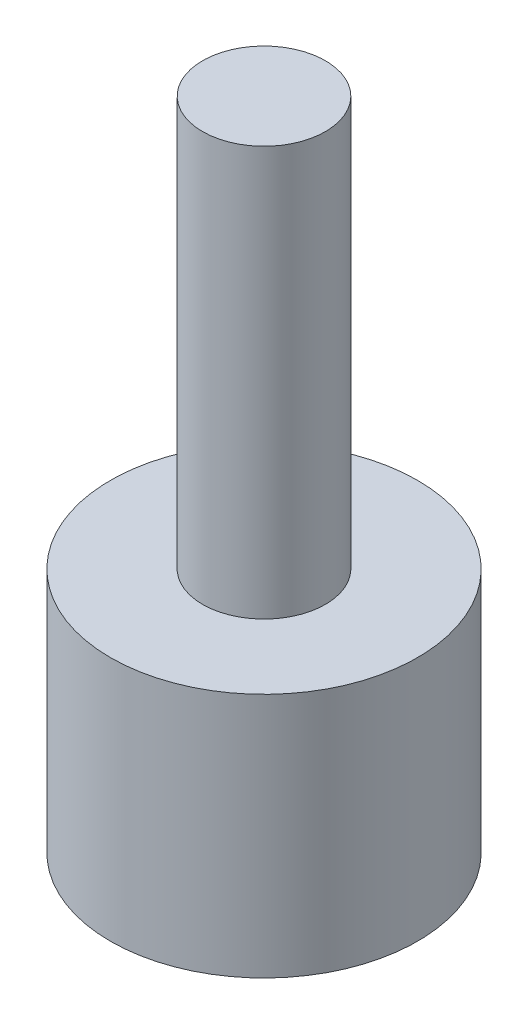
from build123d import *

# Parameters (mm, degrees)
SKETCH2_R           = 3.75
BOSS_EXTRUDE1_DEPTH = 6
SKETCH3_R           = 1.5
BOSS_EXTRUDE2_DEPTH = 10


with BuildPart() as part:
    # Sketch2 → Boss-Extrude1 (new body)
    with BuildSketch(Plane(origin=(0, 0, 0), x_dir=(1, 0, 0), z_dir=(0, 1, 0))):
        with Locations(Location((0, 0, 0), (0, 0, 270))):
            Circle(SKETCH2_R)
    extrude(amount=BOSS_EXTRUDE1_DEPTH)

    # Sketch3 → Boss-Extrude2 (add)
    with BuildSketch(Plane(origin=(0, 6, 0), x_dir=(1, 0, 0), z_dir=(0, 1, 0))):
        with Locations(Location((0, 0, 0), (0, 0, 270))):
            Circle(SKETCH3_R)
    extrude(amount=BOSS_EXTRUDE2_DEPTH)


solid = part.part
